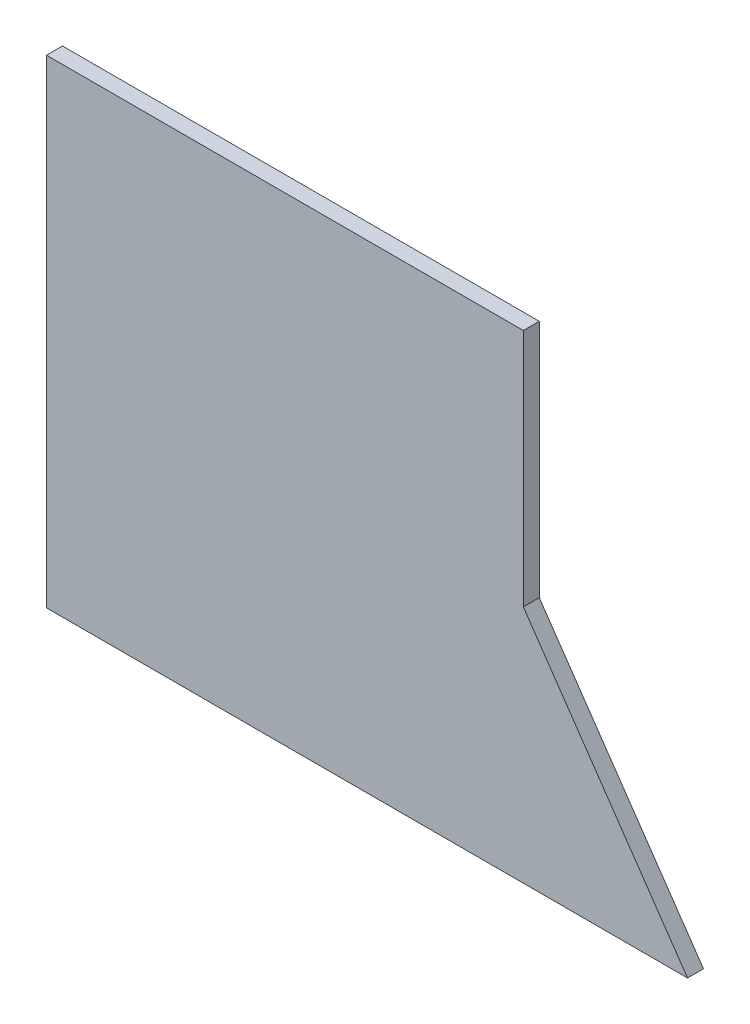
from build123d import *

# Parameters (mm, degrees)
BOSS_EXTRUDE1_DEPTH = 0.01


with BuildPart() as part:
    # Sketch2 → Boss-Extrude1 (new, symmetric)
    with BuildSketch(Plane.XY):
        Polygon((0, 0.35), (0.297683813, 0.35), (0.297683813, 0.05), (0.503527092, -0.25), (0.297683813, -0.25), (-0.3, -0.25), (-0.3, 0.35), align=None)
    extrude(amount=BOSS_EXTRUDE1_DEPTH, both=True)


solid = part.part
